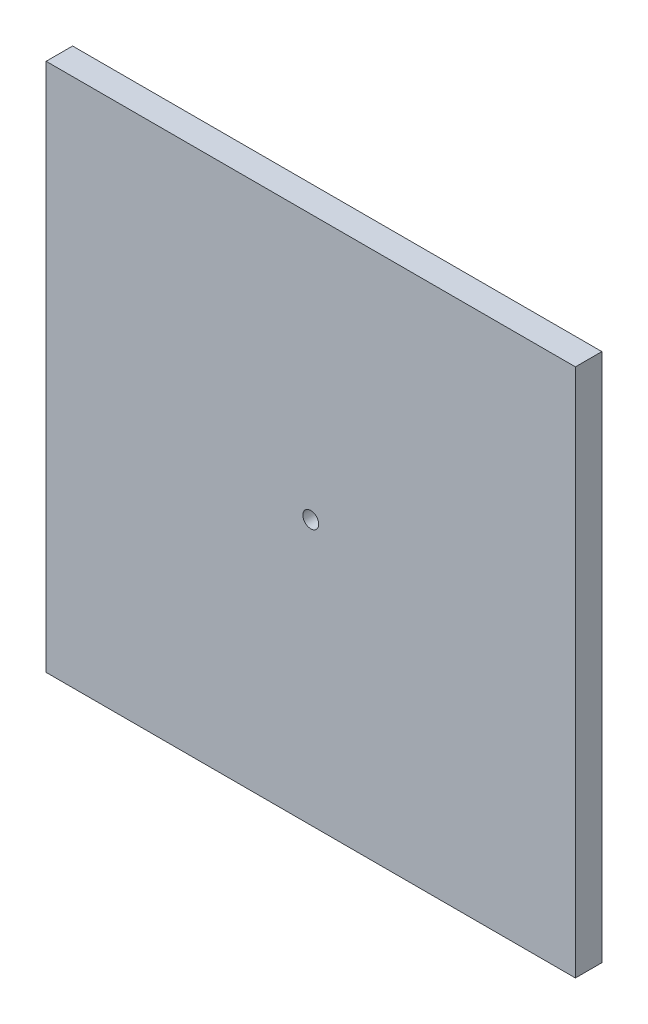
from build123d import *

# Parameters (mm, degrees)
SKETCH1_W           = 100
SKETCH1_H           = 100
SKETCH1_R           = 1.5
BOSS_EXTRUDE1_DEPTH = 5


with BuildPart() as part:
    # Sketch1 → Boss-Extrude1 (new body)
    with BuildSketch(Plane.XY):
        Rectangle(SKETCH1_W, SKETCH1_H)
        Circle(SKETCH1_R, mode=Mode.SUBTRACT)
    extrude(amount=BOSS_EXTRUDE1_DEPTH)


solid = part.part
